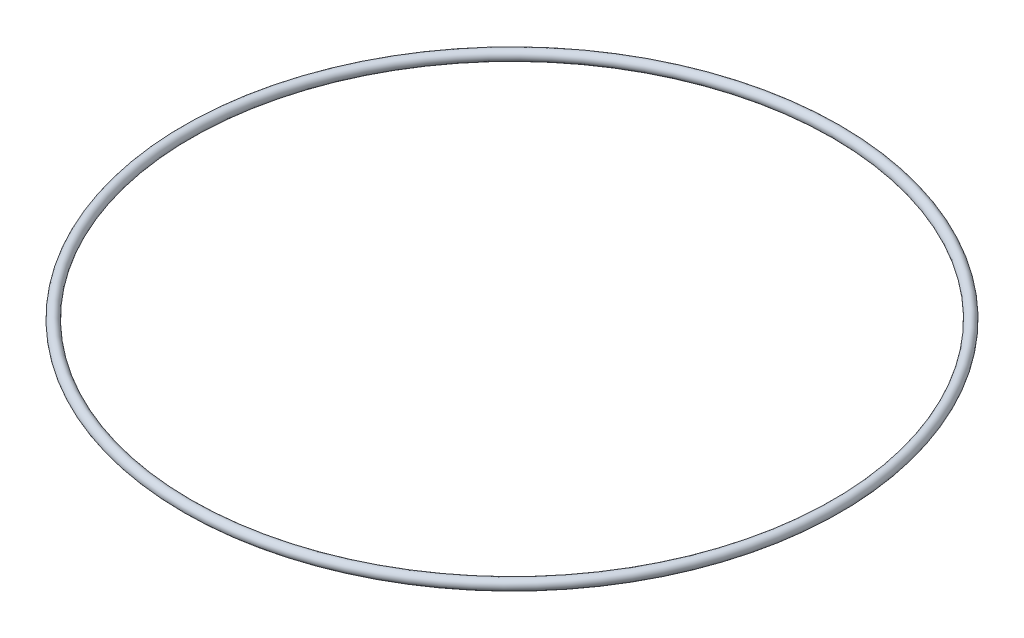
from build123d import *

# Parameters (mm, degrees)
SWEEP1_PROFILE_R = 1


with BuildPart() as part:
    # Sweep1: sweep along a path in Sketch1
    with BuildLine(Plane(origin=(0, 0, 0), x_dir=(1, 0, 0), z_dir=(0, 1, 0))) as sweep1_path:
        CenterArc((0, 0), 63, 0, 360)
    # Sweep1 profile (on start of the path) → Sweep1 (sweep)
    with BuildSketch(Plane(origin=(63, 0, 0), x_dir=(-1, 0, 0), z_dir=(0, 0, -1))):
        Circle(SWEEP1_PROFILE_R)
    sweep(path=sweep1_path.line)


solid = part.part
